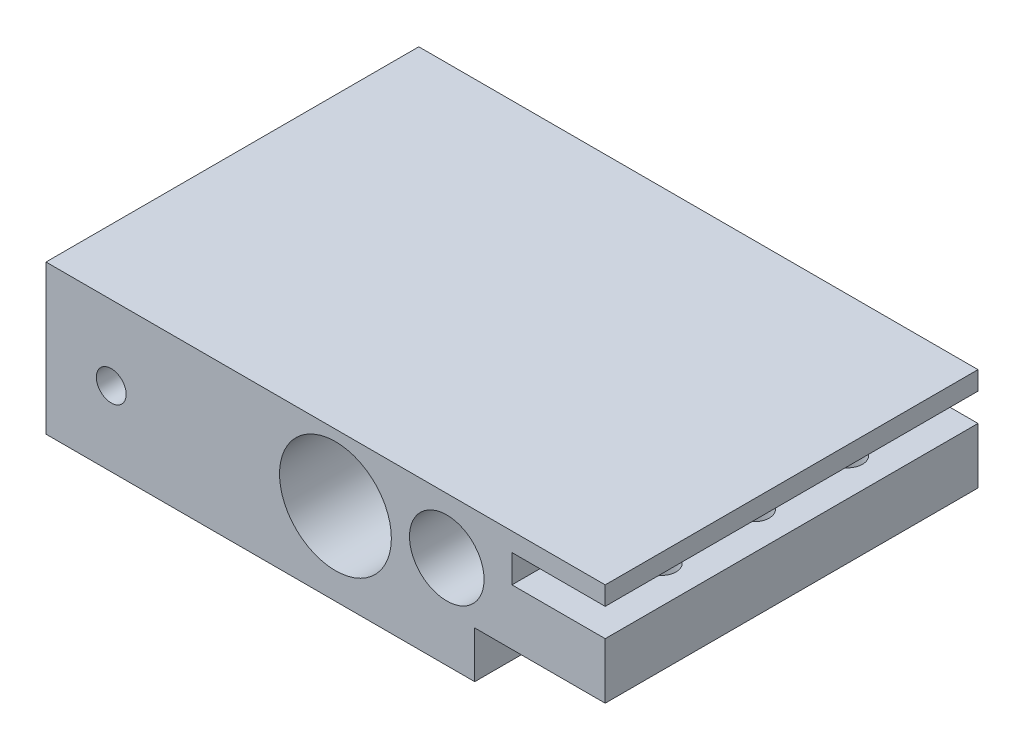
from build123d import *

# Parameters (mm, degrees)
SKETCH1_R                  = 3
SKETCH1_R_2                = 2
BOSS_EXTRUDE1_DEPTH        = 20
SKETCH2_R                  = 3
CUT_EXTRUDE1_DEPTH         = 7
M2X0_4_TAPPED_HOLE1_REACH  = 31.847
M2X0_4_TAPPED_HOLE1_BORE_R = 0.8
M2X0_4_TAPPED_HOLE2_REACH  = 31.982
M2X0_4_TAPPED_HOLE2_BORE_R = 0.8
M2X0_4_TAPPED_HOLE3_D      = 1.6
M2X0_4_TAPPED_HOLE3_DEPTH  = 3


with BuildPart() as part:
    # Sketch1 → Boss-Extrude1 (new body)
    with BuildSketch(Plane.XY):
        Polygon((20.660587733, -2.988994126), (20.660587733, -5.988994126), (13.660587733, -5.988994126), (13.660587733, -8.488994126), (-9.339412267, -8.488994126), (-9.339412267, -2.742720205), (-9.339412267, -0.488994126), (20.660587733, -0.488994126), (20.660587733, -1.488994126), (15.660587733, -1.488994126), (15.660587733, -2.988994126), align=None)
        with Locations((6.188452756, -4.06657859)):
            Circle(SKETCH1_R, mode=Mode.SUBTRACT)
        with Locations((12.160587733, -3.488994126)):
            Circle(SKETCH1_R_2, mode=Mode.SUBTRACT)
    extrude(amount=BOSS_EXTRUDE1_DEPTH)

    # Sketch2 → Cut-Extrude1 (cut)
    with BuildSketch(Plane.ZY.offset(9.339412267)):
        with Locations(Location((6, -4.488994126, 0), (0, 0, 270))):
            Circle(SKETCH2_R)
        with Locations(Location((14, -4.488994126, 0), (0, 0, 270))):
            Circle(SKETCH2_R)
    extrude(amount=-CUT_EXTRUDE1_DEPTH, mode=Mode.SUBTRACT)

    # M2x0.4 Tapped Hole1 bore → M2x0.4 Tapped Hole1 (cut, up to next)
    with BuildSketch(Plane(origin=(0, -8.488994126, 0), x_dir=(-1, 0, 0), z_dir=(0, -1, 0)), mode=Mode.PRIVATE) as m2x0_4_tapped_hole1_sk1:
        with Locations((-12.160587733, -10)):
            Circle(M2X0_4_TAPPED_HOLE1_BORE_R)
    m2x0_4_tapped_hole1_tool1 = extrude(m2x0_4_tapped_hole1_sk1.sketch, amount=-M2X0_4_TAPPED_HOLE1_REACH, mode=Mode.PRIVATE) & part.part
    # M2x0.4 Tapped Hole1 bore → M2x0.4 Tapped Hole1 (cut, up to next)
    with BuildSketch(Plane(origin=(0, -8.488994126, 0), x_dir=(-1, 0, 0), z_dir=(0, -1, 0)), mode=Mode.PRIVATE) as m2x0_4_tapped_hole1_sk2:
        with Locations((-6.188452756, -10)):
            Circle(M2X0_4_TAPPED_HOLE1_BORE_R)
    m2x0_4_tapped_hole1_tool2 = extrude(m2x0_4_tapped_hole1_sk2.sketch, amount=-M2X0_4_TAPPED_HOLE1_REACH, mode=Mode.PRIVATE) & part.part
    add(m2x0_4_tapped_hole1_tool1.solids().sort_by_distance((12.160588, -8.488994, 10))[0], mode=Mode.SUBTRACT)
    add(m2x0_4_tapped_hole1_tool2.solids().sort_by_distance((6.188453, -8.488994, 10))[0], mode=Mode.SUBTRACT)

    # M2x0.4 Tapped Hole2 bore → M2x0.4 Tapped Hole2 (cut, up to next)
    with BuildSketch(Plane(origin=(0, 0, 0), x_dir=(-1, 0, 0), z_dir=(0, 0, -1)), mode=Mode.PRIVATE) as m2x0_4_tapped_hole2_sk1:
        with Locations((5.839412267, -4.488994126)):
            Circle(M2X0_4_TAPPED_HOLE2_BORE_R)
    m2x0_4_tapped_hole2_tool1 = extrude(m2x0_4_tapped_hole2_sk1.sketch, amount=-M2X0_4_TAPPED_HOLE2_REACH, mode=Mode.PRIVATE) & part.part
    m2x0_4_tapped_hole2 = m2x0_4_tapped_hole2_tool1.solids().sort_by_distance((-5.839412, -4.488994, 0))[0]
    add(m2x0_4_tapped_hole2, mode=Mode.SUBTRACT)

    # Mirror1: M2x0.4 Tapped Hole2 across plane
    add(m2x0_4_tapped_hole2.mirror(Plane(origin=(0, 0, 10), x_dir=(1, 0, 0), z_dir=(0, 0, -1))), mode=Mode.SUBTRACT)

    # M2x0.4 Tapped Hole3
    with Locations(Plane(origin=(0, -5.988994126, 0), x_dir=(-1, 0, 0), z_dir=(0, -1, 0))):
        with Locations((-18.660587733, -5), (-18.660587733, -15), (-18.660587733, -10)):
            Hole(M2X0_4_TAPPED_HOLE3_D / 2, depth=M2X0_4_TAPPED_HOLE3_DEPTH)


solid = part.part
